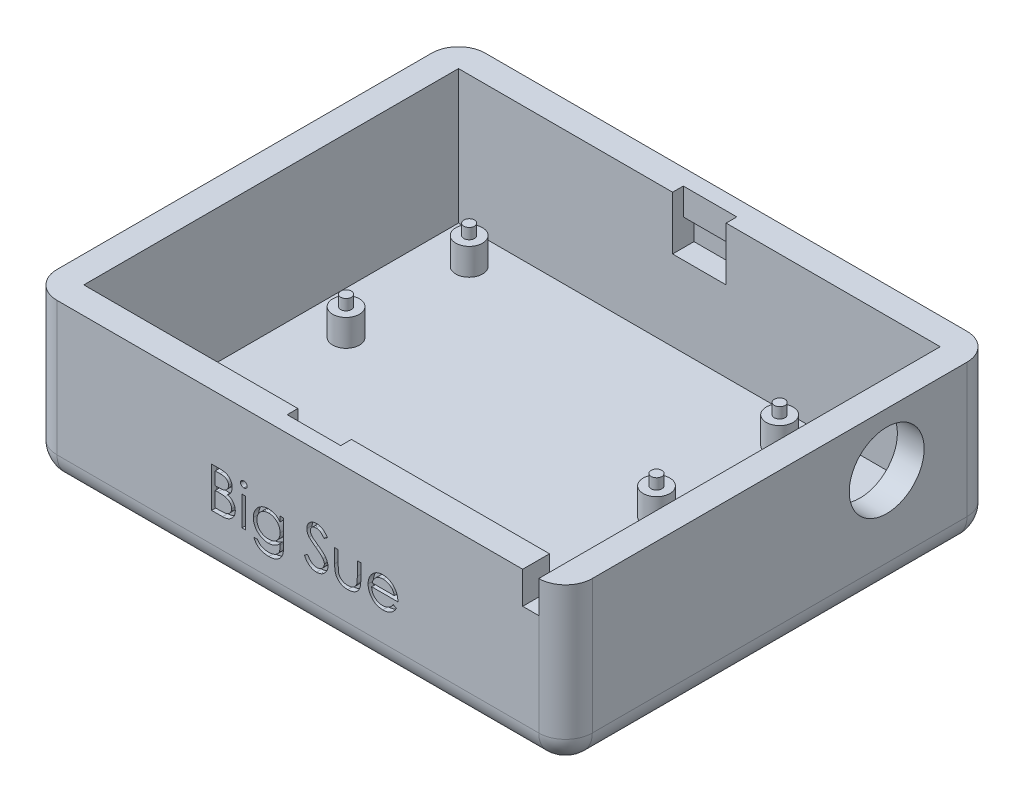
from build123d import *

# Parameters (mm, degrees)
SKETCH1_W            = 100
SKETCH1_H            = 80
BOSS_EXTRUDE1_DEPTH  = 5
SKETCH2_W            = 100
SKETCH2_H            = 80
SKETCH2_W_2          = 90
SKETCH2_H_2          = 70
BOSS_EXTRUDE2_DEPTH  = 25
SKETCH3_R            = 7
CUT_EXTRUDE1_DEPTH   = 25
SKETCH4_R            = 2.5
BOSS_EXTRUDE3_DEPTH  = 5
SKETCH5_R            = 1
BOSS_EXTRUDE4_DEPTH  = 2
LPATTERN1_COUNT      = 2
LPATTERN1_PITCH      = 58
LPATTERN1_COUNT_DIR2 = 2
LPATTERN1_PITCH_DIR2 = 23
SKETCH7_W            = 3
SKETCH7_H            = 6
CUT_EXTRUDE3_DEPTH   = 5
FILLET1_R            = 5
SKETCH8_W            = 10
SKETCH8_H            = 2
CUT_EXTRUDE4_DEPTH   = 10
SKETCH9_W            = 10
SKETCH9_H            = 5
CUT_EXTRUDE5_DEPTH   = 2
SKETCH10_W           = 0.673076924
SKETCH10_H           = 5.480769231
CUT_EXTRUDE6_DEPTH   = 1


with BuildPart() as part:
    # Sketch1 → Boss-Extrude1 (new body)
    with BuildSketch(Plane(origin=(0, 0, 0), x_dir=(1, 0, 0), z_dir=(0, 1, 0))):
        with Locations((50, 40)):
            Rectangle(SKETCH1_W, SKETCH1_H)
    extrude(amount=BOSS_EXTRUDE1_DEPTH)

    # Sketch2 → Boss-Extrude2 (add)
    with BuildSketch(Plane(origin=(0, 5, 0), x_dir=(1, 0, 0), z_dir=(0, 1, 0))):
        with Locations((50, 40)):
            Rectangle(SKETCH2_W, SKETCH2_H)
        with Locations((50, 40)):
            Rectangle(SKETCH2_W_2, SKETCH2_H_2, mode=Mode.SUBTRACT)
    extrude(amount=BOSS_EXTRUDE2_DEPTH)

    # Sketch3 → Cut-Extrude1 (cut)
    with BuildSketch(Plane(origin=(100, 0, 0), x_dir=(0, 0, -1), z_dir=(1, 0, 0))):
        with Locations((60, 20)):
            Circle(SKETCH3_R)
    extrude(amount=-CUT_EXTRUDE1_DEPTH, mode=Mode.SUBTRACT)

    # Sketch4 → Boss-Extrude3 (add)
    with BuildSketch(Plane(origin=(0, 5, 0), x_dir=(1, 0, 0), z_dir=(0, 1, 0))):
        with Locations(Location((13, 69, 0), (0, 0, 90))):
            Circle(SKETCH4_R)
    boss_extrude3 = extrude(amount=BOSS_EXTRUDE3_DEPTH)

    # Sketch5 → Boss-Extrude4 (add)
    with BuildSketch(Plane(origin=(0, 10, 0), x_dir=(1, 0, 0), z_dir=(0, 1, 0))):
        with Locations(Location((13, 69, 0), (0, 0, 270))):
            Circle(SKETCH5_R)
    boss_extrude4 = extrude(amount=BOSS_EXTRUDE4_DEPTH)

    # LPattern1: Boss-Extrude3, Boss-Extrude4 2 × 2
    with Locations(*[(i * LPATTERN1_PITCH, 0, j * LPATTERN1_PITCH_DIR2) for i in range(LPATTERN1_COUNT) for j in range(LPATTERN1_COUNT_DIR2) if (i, j) != (0, 0)]):
        add(boss_extrude3)
        add(boss_extrude4)

    # Sketch7 → Cut-Extrude3 (cut)
    with BuildSketch(Plane.XY):
        with Locations((93.5, 27)):
            Rectangle(SKETCH7_W, SKETCH7_H)
    extrude(amount=-CUT_EXTRUDE3_DEPTH, mode=Mode.SUBTRACT)

    # Fillet1
    fillet1_edges = [part.edges().sort_by_distance(p)[0] for p in [
        (50, 0, 0),
        (100, 0, -40),
        (50, 0, -80),
        (0, 0, -40),
        (0, 15, 0),
        (100, 15, 0),
        (100, 15, -80),
        (0, 15, -80),
    ]]
    fillet(fillet1_edges, radius=FILLET1_R)

    # Sketch8 → Cut-Extrude4 (cut)
    with BuildSketch(Plane(origin=(0, 30, 0), x_dir=(1, 0, 0), z_dir=(0, 1, 0))):
        with Locations((50, 76)):
            Rectangle(SKETCH8_W, SKETCH8_H)
    cut_extrude4 = extrude(amount=-CUT_EXTRUDE4_DEPTH, mode=Mode.SUBTRACT)

    # Sketch9 → Cut-Extrude5 (cut)
    with BuildSketch(Plane.XY.offset(-77)):
        with Locations((50, 22.5)):
            Rectangle(SKETCH9_W, SKETCH9_H)
    cut_extrude5 = extrude(amount=-CUT_EXTRUDE5_DEPTH, mode=Mode.SUBTRACT)

    # Mirror1: Cut-Extrude4, Cut-Extrude5 across plane
    add(cut_extrude4.mirror(Plane.XY.offset(-40)), mode=Mode.SUBTRACT)
    add(cut_extrude5.mirror(Plane.XY.offset(-40)), mode=Mode.SUBTRACT)

    # Sketch10 → Cut-Extrude6 (cut)
    # profile 1 of 7: a face of its own
    with BuildSketch(Plane.XY):
        with BuildLine():
            Line((33.882124968, 17.957661523), (35.345466315, 17.957661523))
            add(Edge.make_bspline(
                [(35.345466315, 17.957661523), (35.417098768, 17.957284915), (35.55594029, 17.956554955), (35.757839094, 17.945233959), (35.946943688, 17.929797524), (36.123308915, 17.905304468), (36.286853277, 17.87575066), (36.438069642, 17.839961054), (36.576477154, 17.797046882), (36.741718732, 17.728804851), (36.930120149, 17.627398062), (37.134116704, 17.477551136), (37.30855436, 17.294267287), (37.458953611, 17.087518739), (37.578527439, 16.860084943), (37.665033076, 16.617386681), (37.719799952, 16.362554377), (37.725432311, 16.18760471), (37.728278815, 16.099187965)],
                knots=[0, 0, 0, 0, 1.001505555, 1.941167018, 2.826882275, 3.653841531, 4.429895133, 5.150066043, 5.825578002, 6.45369114, 7.647487171, 8.808567382, 9.977351308, 11.170798116, 12.373658725, 13.556498008, 14.765093433, 16, 16, 16, 16], degree=3))
            add(Edge.make_bspline(
                [(37.728278815, 16.099187965), (37.725936204, 16.01636106), (37.721332752, 15.853598381), (37.677312554, 15.615539575), (37.608396836, 15.38892982), (37.512599873, 15.174596137), (37.388095595, 14.977381252), (37.240542055, 14.795694253), (37.062520336, 14.637227703), (36.929141964, 14.548635769), (36.861391795, 14.50363508)],
                knots=[0, 0, 0, 0, 1.044552857, 2.05264487, 3.044412934, 4.028983338, 5.005914585, 5.980388656, 6.974128949, 8, 8, 8, 8], degree=3))
            add(Edge.make_bspline(
                [(36.861391795, 14.50363508), (36.946592712, 14.470924368), (37.10960317, 14.408340673), (37.33393034, 14.29769325), (37.527205008, 14.177345871), (37.690913178, 14.045920478), (37.830922438, 13.90425874), (37.953178741, 13.750283496), (38.057495972, 13.581986157), (38.146880808, 13.401121439), (38.216628142, 13.209536149), (38.268862223, 13.009027343), (38.298792471, 12.800314011), (38.303051703, 12.658273912), (38.305201891, 12.586567773)],
                knots=[0, 0, 0, 0, 1.27268992, 2.434971085, 3.483601985, 4.442670788, 5.356604649, 6.2567628, 7.179492994, 8.113709626, 9.066344395, 10.018646069, 10.999752585, 12, 12, 12, 12], degree=3))
            add(Edge.make_bspline(
                [(38.305201891, 12.586567773), (38.30310865, 12.513353047), (38.298990139, 12.369301022), (38.268604485, 12.157682877), (38.217156398, 11.955450848), (38.146289656, 11.761296885), (38.053798982, 11.575596597), (37.941239059, 11.398139603), (37.807028565, 11.230708895), (37.656893846, 11.071443988), (37.487046391, 10.928241586), (37.303798345, 10.800707929), (37.104841945, 10.69582351), (36.893444815, 10.60771775), (36.667235566, 10.540416611), (36.427229979, 10.493332524), (36.173635047, 10.461607444), (35.999614151, 10.458999148), (35.910370161, 10.457661523)],
                knots=[0, 0, 0, 0, 0.978564426, 1.925352924, 2.850884081, 3.763762016, 4.682927383, 5.618979971, 6.567305752, 7.547517671, 8.540179244, 9.531824382, 10.526200242, 11.540722885, 12.589160233, 13.674978461, 14.80764778, 16, 16, 16, 16], degree=3))
            Line((35.910370161, 10.457661523), (33.882124968, 10.457661523))
            Line((33.882124968, 10.457661523), (33.882124968, 17.957661523))
        make_face()
        with BuildLine():
            Line((34.555201891, 17.188430754), (34.555201891, 14.7845846))
            Line((34.555201891, 14.7845846), (35.007425449, 14.7845846))
            add(Edge.make_bspline(
                [(35.007425449, 14.7845846), (35.073530011, 14.785441578), (35.201257495, 14.787097433), (35.386228702, 14.791840684), (35.557925169, 14.805122206), (35.716050526, 14.81839991), (35.860355763, 14.839988312), (35.99052118, 14.865685719), (36.108589602, 14.892863372), (36.244745771, 14.939083702), (36.399187804, 15.007393006), (36.56383017, 15.113404083), (36.708975462, 15.239670554), (36.831540864, 15.385365472), (36.931851158, 15.545793013), (37.001523405, 15.718393471), (37.048767585, 15.898865183), (37.053035152, 16.022761439), (37.055201891, 16.08566633)],
                knots=[0, 0, 0, 0, 1.156816544, 2.235205308, 3.236616184, 4.169592532, 5.011045266, 5.787822928, 6.49130361, 7.128639758, 8.301311294, 9.436451833, 10.541879658, 11.654887649, 12.756523258, 13.837046038, 14.901820046, 16, 16, 16, 16], degree=3))
            add(Edge.make_bspline(
                [(37.055201891, 16.08566633), (37.054074363, 16.127292984), (37.051862591, 16.20894821), (37.033748371, 16.32798254), (37.002960712, 16.439933438), (36.963415798, 16.546335103), (36.908154322, 16.643860497), (36.843089758, 16.73588163), (36.764477564, 16.819264741), (36.674997609, 16.89719938), (36.572121988, 16.966294797), (36.455912077, 17.026810718), (36.324795626, 17.075540954), (36.180982366, 17.118218424), (36.022258607, 17.148193339), (35.850455992, 17.173164884), (35.664167309, 17.185877902), (35.535284946, 17.187560823), (35.46866343, 17.188430754)],
                knots=[0, 0, 0, 0, 0.91205012, 1.789085906, 2.630437955, 3.453916878, 4.269457761, 5.079663411, 5.91843418, 6.774407191, 7.675494373, 8.627863946, 9.638891023, 10.736472738, 11.911756761, 13.175263542, 14.539845004, 16, 16, 16, 16], degree=3))
            Line((35.46866343, 17.188430754), (34.555201891, 17.188430754))
        make_face(mode=Mode.SUBTRACT)
        with BuildLine():
            Line((34.555201891, 14.01535383), (34.555201891, 11.226892292))
            Line((34.555201891, 11.226892292), (35.513735545, 11.226892292))
            add(Edge.make_bspline(
                [(35.513735545, 11.226892292), (35.582347529, 11.227714608), (35.714588084, 11.229299513), (35.905519291, 11.234473559), (36.082483085, 11.246242721), (36.244671947, 11.264769542), (36.393837203, 11.284866218), (36.528189423, 11.311890392), (36.648817695, 11.34285245), (36.788691212, 11.390711391), (36.94619873, 11.465060971), (37.115936279, 11.577162885), (37.266849604, 11.71071283), (37.39500373, 11.865279075), (37.500031563, 12.033346204), (37.57643611, 12.211514811), (37.623559374, 12.396840941), (37.629264022, 12.523198182), (37.632124968, 12.586567773)],
                knots=[0, 0, 0, 0, 1.160039823, 2.235823828, 3.228722157, 4.157150951, 4.99529583, 5.772374946, 6.472645482, 7.099169577, 8.269452708, 9.405989375, 10.527446681, 11.663510218, 12.788923519, 13.866172445, 14.929861265, 16, 16, 16, 16], degree=3))
            add(Edge.make_bspline(
                [(37.632124968, 12.586567773), (37.631533316, 12.62619636), (37.630359555, 12.704814321), (37.612658238, 12.820348219), (37.586914231, 12.932260804), (37.553632587, 13.040855963), (37.5051623, 13.144170341), (37.448576847, 13.244247254), (37.382230986, 13.341218995), (37.278850631, 13.463816681), (37.128482092, 13.605067423), (36.914824716, 13.743362071), (36.671884078, 13.854893086), (36.495682307, 13.902249107), (36.404661026, 13.926712004)],
                knots=[0, 0, 0, 0, 0.723448775, 1.435228256, 2.130040452, 2.821711965, 3.505591119, 4.210454504, 4.921174351, 5.648778258, 7.137944449, 8.670945889, 10.280296675, 12, 12, 12, 12], degree=3))
            add(Edge.make_bspline(
                [(36.404661026, 13.926712004), (36.368170106, 13.934115755), (36.289050266, 13.950168615), (36.160034022, 13.967113694), (36.012742874, 13.982210251), (35.846836709, 13.993377017), (35.662105621, 14.00491961), (35.458155081, 14.009408513), (35.235817978, 14.01476407), (35.081548608, 14.015152215), (35.001415834, 14.01535383)],
                knots=[0, 0, 0, 0, 0.634451884, 1.375622551, 2.216452059, 3.157844607, 4.20941857, 5.370758133, 6.634282058, 8, 8, 8, 8], degree=3))
            Line((35.001415834, 14.01535383), (34.555201891, 14.01535383))
        make_face(mode=Mode.SUBTRACT)
    # profile 2 of 7: a face of its own
    with BuildSketch(Plane.XY):
        with BuildLine():
            add(Edge.make_bspline(
                [(39.888735545, 18.246123061), (39.930502651, 18.244185592), (40.012290665, 18.240391655), (40.130561952, 18.207902775), (40.23825555, 18.152832021), (40.333779263, 18.07894699), (40.415747592, 17.992055326), (40.473134828, 17.890781822), (40.510018534, 17.781370453), (40.514472581, 17.705052405), (40.516740353, 17.666195177)],
                knots=[0, 0, 0, 0, 1.055194115, 2.066272739, 3.074728998, 4.095836921, 5.109056067, 6.073838105, 7.019297344, 8, 8, 8, 8], degree=3))
            add(Edge.make_bspline(
                [(40.516740353, 17.666195177), (40.514421439, 17.628346634), (40.509837221, 17.553524545), (40.473163317, 17.446009962), (40.415258522, 17.34614364), (40.333831824, 17.25942069), (40.238241622, 17.185576504), (40.130565652, 17.130494921), (40.012289691, 17.098008912), (39.930502322, 17.094214579), (39.888735545, 17.092276907)],
                knots=[0, 0, 0, 0, 0.96129708, 1.900370562, 2.859976407, 3.87933698, 4.906634145, 5.921202961, 6.938410037, 8, 8, 8, 8], degree=3))
            add(Edge.make_bspline(
                [(39.888735545, 17.092276907), (39.847446384, 17.094140594), (39.767082427, 17.097768015), (39.65058205, 17.131132339), (39.543806716, 17.185595353), (39.448096703, 17.258937178), (39.368317718, 17.346676243), (39.310249878, 17.445949016), (39.273660674, 17.553540062), (39.269065041, 17.628351847), (39.266740353, 17.666195177)],
                knots=[0, 0, 0, 0, 1.054934014, 2.053291228, 3.073705704, 4.106921865, 5.123545215, 6.088680038, 7.033164197, 8, 8, 8, 8], degree=3))
            add(Edge.make_bspline(
                [(39.266740353, 17.666195177), (39.26901411, 17.705046997), (39.273479912, 17.781354424), (39.310277304, 17.89084378), (39.367834035, 17.991518427), (39.448149528, 18.079430212), (39.543792657, 18.152813286), (39.650585683, 18.207265389), (39.767081467, 18.240632545), (39.847446059, 18.244259576), (39.888735545, 18.246123061)],
                knots=[0, 0, 0, 0, 0.98631895, 1.937192651, 2.907499808, 3.917963147, 4.944918757, 5.95915025, 6.951458133, 8, 8, 8, 8], degree=3))
        make_face()
    # profile 3 of 7: a face of its own
    with BuildSketch(Plane.XY):
        with Locations((39.891740353, 13.198046139)):
            Rectangle(SKETCH10_W, SKETCH10_H)
    # profile 4 of 7: a face of its own
    with BuildSketch(Plane.XY):
        with BuildLine():
            Line((46.670586507, 15.938430754), (47.34366343, 15.938430754))
            Line((47.34366343, 15.938430754), (47.34366343, 11.588971619))
            add(Edge.make_bspline(
                [(47.34366343, 11.588971619), (47.343069767, 11.49631963), (47.341923855, 11.317478975), (47.333671774, 11.058882661), (47.316270323, 10.820026764), (47.296537434, 10.599821924), (47.268151614, 10.399288831), (47.23348797, 10.217829107), (47.194411514, 10.055268616), (47.160082477, 9.955143956), (47.143843718, 9.907781715)],
                knots=[0, 0, 0, 0, 1.307562039, 2.523909702, 3.650326591, 4.686913197, 5.643429486, 6.506965704, 7.293745905, 8, 8, 8, 8], degree=3))
            add(Edge.make_bspline(
                [(47.143843718, 9.907781715), (47.119866778, 9.846217597), (47.072629793, 9.724930089), (46.984160578, 9.552999402), (46.885087928, 9.391114281), (46.771930605, 9.240176885), (46.645200311, 9.10094493), (46.507882828, 8.970393503), (46.357303846, 8.851284573), (46.193549463, 8.745673221), (46.020394534, 8.650558105), (45.837938601, 8.568172604), (45.647210519, 8.496415082), (45.446418609, 8.442666234), (45.238710963, 8.396091833), (45.02164504, 8.365781792), (44.796489046, 8.345152382), (44.643391803, 8.34324474), (44.565718718, 8.342276907)],
                knots=[0, 0, 0, 0, 0.981931301, 1.934503488, 2.87077864, 3.801706999, 4.735015492, 5.667491629, 6.616593066, 7.585388521, 8.561939025, 9.551802639, 10.560317337, 11.588439944, 12.640189604, 13.723962949, 14.845264515, 16, 16, 16, 16], degree=3))
            add(Edge.make_bspline(
                [(44.565718718, 8.342276907), (44.452394287, 8.344112234), (44.231041226, 8.34769712), (43.908316242, 8.389463367), (43.60181327, 8.448508452), (43.315582292, 8.537877226), (43.051432084, 8.647242204), (42.811166637, 8.772802817), (42.596942835, 8.916779907), (42.403820678, 9.080709766), (42.229517271, 9.275631941), (42.065530221, 9.50534375), (41.907685345, 9.773344227), (41.815181121, 9.970042898), (41.766740353, 10.073046138)],
                knots=[0, 0, 0, 0, 1.157897085, 2.2616841, 3.32207898, 4.345638746, 5.321241055, 6.241986252, 7.112515963, 7.955008012, 8.825025602, 9.77857164, 10.836726669, 12, 12, 12, 12], degree=3))
            Line((41.766740353, 10.073046138), (42.439817276, 10.073046138))
            add(Edge.make_bspline(
                [(42.439817276, 10.073046138), (42.493950582, 9.987104976), (42.599774528, 9.819100586), (42.79766413, 9.601572395), (43.01453483, 9.415672328), (43.257705579, 9.265863526), (43.528188184, 9.152913973), (43.826145368, 9.072395481), (44.154001701, 9.024189195), (44.382255017, 9.018379279), (44.501115353, 9.01535383)],
                knots=[0, 0, 0, 0, 0.997731894, 1.950442991, 2.880492273, 3.800895997, 4.748200782, 5.754801363, 6.83083817, 8, 8, 8, 8], degree=3))
            add(Edge.make_bspline(
                [(44.501115353, 9.01535383), (44.618472975, 9.018418435), (44.844726724, 9.024326686), (45.170079229, 9.072416995), (45.467068382, 9.152931496), (45.733983097, 9.265663752), (45.96767403, 9.403771766), (46.169128297, 9.55805764), (46.33229546, 9.732016932), (46.442037532, 9.892263659), (46.510254569, 10.035029651), (46.553695077, 10.157928071), (46.58899644, 10.296898523), (46.618524663, 10.451475101), (46.642890906, 10.621878652), (46.658325654, 10.808498802), (46.669480964, 11.010911421), (46.670209471, 11.15125386), (46.670586507, 11.223887484)],
                knots=[0, 0, 0, 0, 1.570740765, 3.028230971, 4.391408896, 5.680370741, 6.894727393, 8.017376726, 9.065722033, 10.075533815, 10.603371122, 11.180248986, 11.817768598, 12.521299649, 13.286540596, 14.121245857, 15.027658897, 16, 16, 16, 16], degree=3))
            Line((46.670586507, 11.223887484), (46.670586507, 11.507841811))
            add(Edge.make_bspline(
                [(46.670586507, 11.507841811), (46.602269827, 11.426537949), (46.466838136, 11.265360336), (46.232951006, 11.054156829), (45.977486187, 10.872257978), (45.700878596, 10.72307519), (45.409903792, 10.603757851), (45.107713298, 10.520308649), (44.797016037, 10.466394578), (44.586475716, 10.460593186), (44.480081699, 10.457661523)],
                knots=[0, 0, 0, 0, 1.012485704, 2.007162095, 2.997754123, 3.998611389, 4.999708251, 5.992315798, 6.98544096, 8, 8, 8, 8], degree=3))
            add(Edge.make_bspline(
                [(44.480081699, 10.457661523), (44.41743255, 10.458765151), (44.292875641, 10.460959347), (44.107829754, 10.480156727), (43.925514529, 10.508011175), (43.746355165, 10.548899973), (43.570093137, 10.601382244), (43.397019725, 10.666989541), (43.225733596, 10.741164795), (43.059348244, 10.828535088), (42.899520821, 10.925740031), (42.747456853, 11.031037654), (42.60395284, 11.143876843), (42.470374649, 11.265370285), (42.346897496, 11.395342141), (42.231860636, 11.532406898), (42.12716632, 11.678478486), (42.030666201, 11.830893395), (41.94697145, 11.990666804), (41.873504939, 12.154334151), (41.809627642, 12.321545482), (41.758701781, 12.492860616), (41.719806539, 12.66817155), (41.690856052, 12.847191083), (41.674435484, 13.030470485), (41.671874933, 13.153944805), (41.670586507, 13.216074984)],
                knots=[0, 0, 0, 0, 1.028754217, 2.045334182, 3.052854819, 4.056607503, 5.061168794, 6.071104265, 7.095078842, 8.125279047, 9.155117945, 10.165957491, 11.161587969, 12.151493252, 13.128948131, 14.104219989, 15.088194871, 16.07871515, 17.064853787, 18.047899887, 19.02414258, 20.002704429, 20.980574569, 21.971845993, 22.979467364, 24, 24, 24, 24], degree=3))
            add(Edge.make_bspline(
                [(41.670586507, 13.216074984), (41.671699006, 13.278224476), (41.673919695, 13.402282745), (41.693100366, 13.586309999), (41.720460771, 13.767873075), (41.763763134, 13.945100521), (41.815882825, 14.120010703), (41.880433337, 14.291311681), (41.958044964, 14.459055629), (42.045922999, 14.623366768), (42.144674627, 14.782040229), (42.252958514, 14.932740184), (42.370905387, 15.074357696), (42.496888064, 15.208321457), (42.632444815, 15.333338942), (42.777505512, 15.449106724), (42.930640256, 15.557565352), (43.092323649, 15.65637536), (43.26006091, 15.743765888), (43.429590519, 15.823507167), (43.603158166, 15.886794566), (43.777527893, 15.94255835), (43.955770568, 15.98206234), (44.135700697, 16.012538573), (44.317934278, 16.031105832), (44.439976196, 16.033423514), (44.501115353, 16.0345846)],
                knots=[0, 0, 0, 0, 1.008818848, 2.013730394, 3.001654427, 3.987803273, 4.973046549, 5.963777569, 6.957074694, 7.972068341, 8.987420212, 9.989399531, 10.982630087, 11.977756091, 12.973280677, 13.973972381, 14.989194003, 16.018387222, 17.047741039, 18.059210846, 19.057554164, 20.045176975, 21.029480261, 22.018708529, 23.007435371, 24, 24, 24, 24], degree=3))
            add(Edge.make_bspline(
                [(44.501115353, 16.0345846), (44.601938794, 16.031677443), (44.801034109, 16.025936701), (45.094029115, 15.980891389), (45.376762486, 15.909075646), (45.650829662, 15.80618501), (45.9184632, 15.665720642), (46.178781033, 15.480700039), (46.432536321, 15.249463597), (46.589131672, 15.07213603), (46.670586507, 14.9798971)],
                knots=[0, 0, 0, 0, 0.96728863, 1.910097829, 2.838038873, 3.762875196, 4.71315279, 5.730631239, 6.819562287, 8, 8, 8, 8], degree=3))
            Line((46.670586507, 14.9798971), (46.670586507, 15.938430754))
        make_face()
        with BuildLine():
            add(Edge.make_bspline(
                [(44.555201891, 15.361507677), (44.456778955, 15.358162536), (44.261922409, 15.351539868), (43.976304533, 15.295001197), (43.700568247, 15.206402839), (43.439985186, 15.079668664), (43.195898522, 14.925181011), (42.979309621, 14.738023252), (42.789870515, 14.524281401), (42.629621362, 14.285888015), (42.502054148, 14.028697424), (42.411746821, 13.757602994), (42.353353914, 13.476985152), (42.346908945, 13.285472431), (42.34366343, 13.189031715)],
                knots=[0, 0, 0, 0, 1.026226791, 2.031711442, 3.026614839, 4.04107745, 5.047145931, 6.032893242, 7.017642609, 8.019221815, 9.021877557, 10.003543541, 10.994637589, 12, 12, 12, 12], degree=3))
            add(Edge.make_bspline(
                [(42.34366343, 13.189031715), (42.345218623, 13.11631756), (42.348277233, 12.97331008), (42.3776849, 12.763443162), (42.42521554, 12.563556776), (42.492580982, 12.373638831), (42.576051042, 12.192599985), (42.681034694, 12.021687339), (42.804572491, 11.860748683), (42.945697501, 11.710974365), (43.101218319, 11.574558004), (43.269902317, 11.454690774), (43.45152071, 11.356653515), (43.641606732, 11.271923148), (43.844772637, 11.210039431), (44.058092107, 11.162813476), (44.283074314, 11.13579471), (44.436442327, 11.132445858), (44.514636988, 11.130738446)],
                knots=[0, 0, 0, 0, 1.039728707, 2.044842319, 3.024901384, 3.974314358, 4.923051295, 5.871625912, 6.837440708, 7.820715446, 8.810779094, 9.792721783, 10.773906224, 11.758876063, 12.764959493, 13.806266761, 14.881525401, 16, 16, 16, 16], degree=3))
            add(Edge.make_bspline(
                [(44.514636988, 11.130738446), (44.593845041, 11.132383322), (44.74873555, 11.135599861), (44.974958985, 11.163250215), (45.189314857, 11.207868736), (45.391606619, 11.271218076), (45.582598064, 11.352050398), (45.760143667, 11.45434315), (45.928050342, 11.570838362), (46.080956934, 11.706721249), (46.219223003, 11.85647481), (46.339717503, 12.019428156), (46.442391322, 12.193129269), (46.527414901, 12.377558567), (46.592324624, 12.574149323), (46.635865135, 12.782410086), (46.66630816, 13.001343097), (46.669138713, 13.151361561), (46.670586507, 13.228094215)],
                knots=[0, 0, 0, 0, 1.121943988, 2.193949579, 3.223793937, 4.220241907, 5.192961521, 6.155822191, 7.11847367, 8.083710714, 9.04790392, 10.001595906, 10.949595423, 11.902125208, 12.873731292, 13.87582262, 14.913508608, 16, 16, 16, 16], degree=3))
            add(Edge.make_bspline(
                [(46.670586507, 13.228094215), (46.667716004, 13.327989616), (46.662108049, 13.523150127), (46.609185568, 13.807521773), (46.523856547, 14.074883217), (46.404184934, 14.324388879), (46.254223487, 14.553395057), (46.07360024, 14.757660438), (45.865430174, 14.937447988), (45.630311388, 15.087229831), (45.377352577, 15.208227191), (45.1126643, 15.299002417), (44.83663952, 15.350418806), (44.649554357, 15.357790113), (44.555201891, 15.361507677)],
                knots=[0, 0, 0, 0, 1.070913519, 2.092188694, 3.091357305, 4.074328408, 5.051968682, 6.018948707, 6.99050112, 7.9935919, 9.000589572, 9.992915277, 10.987769056, 12, 12, 12, 12], degree=3))
        make_face(mode=Mode.SUBTRACT)
    # profile 5 of 7: a face of its own
    with BuildSketch(Plane.XY):
        with BuildLine():
            Line((51.189817276, 11.904476427), (51.823831699, 12.2845846))
            add(Edge.make_bspline(
                [(51.823831699, 12.2845846), (51.88279935, 12.185875203), (51.995779095, 11.996751809), (52.184246293, 11.741198866), (52.379531102, 11.523994244), (52.583079674, 11.346401513), (52.793649563, 11.20658247), (53.012615393, 11.107577688), (53.239239273, 11.04582917), (53.39346889, 11.038328984), (53.470466315, 11.0345846)],
                knots=[0, 0, 0, 0, 1.272034388, 2.437168799, 3.508375237, 4.49857839, 5.41946034, 6.295179144, 7.148887113, 8, 8, 8, 8], degree=3))
            add(Edge.make_bspline(
                [(53.470466315, 11.0345846), (53.536223873, 11.036416041), (53.666588386, 11.040046877), (53.858507479, 11.07493431), (54.044897055, 11.128531729), (54.221915564, 11.205290868), (54.387120453, 11.298159052), (54.531991943, 11.410329432), (54.657233614, 11.535914159), (54.759681716, 11.676019847), (54.838281792, 11.826699451), (54.898693367, 11.981362204), (54.932218525, 12.142437708), (54.937268711, 12.2508887), (54.939817276, 12.305618254)],
                knots=[0, 0, 0, 0, 1.095163259, 2.171163733, 3.241058638, 4.321873601, 5.38011039, 6.391990106, 7.366004449, 8.327778327, 9.272591725, 10.192022065, 11.087607919, 12, 12, 12, 12], degree=3))
            add(Edge.make_bspline(
                [(54.939817276, 12.305618254), (54.936658039, 12.368062931), (54.930235771, 12.495003837), (54.875954028, 12.682288807), (54.790562785, 12.867630029), (54.711785691, 12.982275598), (54.670886988, 13.041796138)],
                knots=[0, 0, 0, 0, 0.938893495, 1.908633276, 2.914225137, 4, 4, 4, 4], degree=3))
            add(Edge.make_bspline(
                [(54.670886988, 13.041796138), (54.6373071, 13.084753617), (54.566810327, 13.174937471), (54.445615657, 13.309177262), (54.303402555, 13.447645302), (54.145037794, 13.595628996), (53.964752604, 13.746245703), (53.768193644, 13.906677727), (53.550342518, 14.070823964), (53.397557882, 14.180908033), (53.318723526, 14.2377096)],
                knots=[0, 0, 0, 0, 0.722233717, 1.516239348, 2.393582979, 3.351407094, 4.387010283, 5.505090956, 6.712668013, 8, 8, 8, 8], degree=3))
            add(Edge.make_bspline(
                [(53.318723526, 14.2377096), (53.239814963, 14.293913716), (53.088947799, 14.401371707), (52.877965122, 14.560852315), (52.689298416, 14.706660607), (52.523786238, 14.840169204), (52.381501387, 14.961396215), (52.261322649, 15.069177513), (52.166311456, 15.166428), (52.113478068, 15.22951659), (52.08975718, 15.257841811)],
                knots=[0, 0, 0, 0, 1.452282411, 2.77665338, 3.964542531, 5.026858415, 5.96415736, 6.766646006, 7.446254459, 8, 8, 8, 8], degree=3))
            add(Edge.make_bspline(
                [(52.08975718, 15.257841811), (52.056601726, 15.30198689), (51.991397076, 15.388804113), (51.905327064, 15.524500236), (51.832171715, 15.663407234), (51.774823861, 15.805898372), (51.726531963, 15.94997322), (51.694050683, 16.097511603), (51.673711975, 16.2478515), (51.671629147, 16.349023287), (51.670586507, 16.399668734)],
                knots=[0, 0, 0, 0, 1.068054152, 2.10047183, 3.106115577, 4.101338837, 5.06977816, 6.043150881, 7.020423561, 8, 8, 8, 8], degree=3))
            add(Edge.make_bspline(
                [(51.670586507, 16.399668734), (51.673383383, 16.479018251), (51.678917355, 16.636021245), (51.725718463, 16.865373024), (51.79958895, 17.084343919), (51.903077995, 17.290766062), (52.036486609, 17.479264593), (52.190870839, 17.652007779), (52.374752596, 17.79722617), (52.576508217, 17.924109152), (52.7973433, 18.023421849), (53.028752379, 18.098338235), (53.271103247, 18.140786644), (53.435252821, 18.146878283), (53.518543238, 18.149969215)],
                knots=[0, 0, 0, 0, 1.005424448, 1.989358655, 2.955360095, 3.929531133, 4.905563448, 5.876582895, 6.856512386, 7.866279853, 8.892233794, 9.918561126, 10.94386622, 12, 12, 12, 12], degree=3))
            add(Edge.make_bspline(
                [(53.518543238, 18.149969215), (53.606923453, 18.14692089), (53.782683492, 18.140858745), (54.041217525, 18.088149749), (54.290133346, 18.000934024), (54.490368914, 17.901958328), (54.647081974, 17.803105295), (54.766594973, 17.713062814), (54.887703796, 17.609401867), (55.011385342, 17.49184634), (55.135543898, 17.359317587), (55.262022724, 17.212723254), (55.391117586, 17.052959206), (55.474165857, 16.938906704), (55.516740353, 16.880437965)],
                knots=[0, 0, 0, 0, 1.286793592, 2.559021753, 3.825965368, 5.121522368, 5.803751409, 6.523245864, 7.299691795, 8.125521123, 9.008227632, 9.944561021, 10.946284179, 12, 12, 12, 12], degree=3))
            Line((55.516740353, 16.880437965), (54.908266795, 16.419199984))
            add(Edge.make_bspline(
                [(54.908266795, 16.419199984), (54.871525511, 16.466532892), (54.800770389, 16.557685006), (54.69335006, 16.685337826), (54.592102957, 16.801944567), (54.492352101, 16.903226985), (54.399365748, 16.994731556), (54.309114943, 17.073073892), (54.222898476, 17.139021597), (54.114219382, 17.209400654), (53.977681414, 17.27916459), (53.806285979, 17.338198329), (53.627172533, 17.373673461), (53.505180465, 17.378363935), (53.443423045, 17.380738446)],
                knots=[0, 0, 0, 0, 1.181633172, 2.275549214, 3.290209073, 4.226197932, 5.078386478, 5.862611352, 6.581680152, 7.217281963, 8.414376989, 9.595101626, 10.782541182, 12, 12, 12, 12], degree=3))
            add(Edge.make_bspline(
                [(53.443423045, 17.380738446), (53.365944783, 17.378141946), (53.216535253, 17.373134841), (53.004413318, 17.318449158), (52.813497765, 17.232345171), (52.649456554, 17.111670218), (52.512877317, 16.968696663), (52.414079906, 16.804170545), (52.354615267, 16.622493968), (52.347358954, 16.495761847), (52.34366343, 16.431219215)],
                knots=[0, 0, 0, 0, 1.14458467, 2.207223713, 3.21896685, 4.227309161, 5.202851033, 6.127160689, 7.046193047, 8, 8, 8, 8], degree=3))
            add(Edge.make_bspline(
                [(52.34366343, 16.431219215), (52.344505844, 16.391037475), (52.34619205, 16.310608291), (52.369709474, 16.191783815), (52.399922321, 16.073259516), (52.44779939, 15.955568268), (52.513896469, 15.836651784), (52.600693274, 15.714462346), (52.710007514, 15.587922971), (52.793743969, 15.505621455), (52.837954295, 15.462168734)],
                knots=[0, 0, 0, 0, 0.858281714, 1.717966888, 2.583508476, 3.4729293, 4.427298488, 5.488583878, 6.674047936, 8, 8, 8, 8], degree=3))
            add(Edge.make_bspline(
                [(52.837954295, 15.462168734), (52.854371522, 15.447517965), (52.893375094, 15.41271109), (52.96468065, 15.355727631), (53.058843789, 15.285435976), (53.173405648, 15.198463155), (53.310478566, 15.097574308), (53.470077615, 14.984059425), (53.650423757, 14.854233441), (53.778399291, 14.763467283), (53.846067276, 14.715474023)],
                knots=[0, 0, 0, 0, 0.420754252, 0.999615792, 1.744751191, 2.668019286, 3.750313428, 4.999500688, 6.413464383, 8, 8, 8, 8], degree=3))
            add(Edge.make_bspline(
                [(53.846067276, 14.715474023), (53.927465662, 14.656242538), (54.085082354, 14.541548977), (54.309348597, 14.369229663), (54.512692471, 14.20069873), (54.695827907, 14.037032429), (54.86056414, 13.87947223), (55.005073541, 13.726122558), (55.130828571, 13.578082045), (55.26621261, 13.388283668), (55.404550795, 13.155181345), (55.523354025, 12.86958512), (55.598264769, 12.582878718), (55.608060874, 12.390178355), (55.612894199, 12.295101427)],
                knots=[0, 0, 0, 0, 1.163667725, 2.253281268, 3.268753668, 4.215851969, 5.092017293, 5.902905408, 6.650798638, 7.335211899, 8.59617414, 9.77448103, 10.901945474, 12, 12, 12, 12], degree=3))
            add(Edge.make_bspline(
                [(55.612894199, 12.295101427), (55.611486046, 12.227862073), (55.608697085, 12.094689108), (55.576637984, 11.899142515), (55.529667273, 11.709219223), (55.4588732, 11.527266839), (55.372466433, 11.349956633), (55.262824473, 11.181939704), (55.135736577, 11.019497421), (54.989949938, 10.866961368), (54.830423005, 10.726933805), (54.661815087, 10.602371531), (54.483850217, 10.498510838), (54.297493824, 10.413759033), (54.102703102, 10.347472924), (53.899543566, 10.299445348), (53.687680327, 10.269968824), (53.543679295, 10.266909335), (53.470466315, 10.26535383)],
                knots=[0, 0, 0, 0, 0.983748083, 1.948392443, 2.894712957, 3.844097841, 4.80183111, 5.778335162, 6.776009319, 7.81870978, 8.863265674, 9.881300176, 10.883814829, 11.87499822, 12.874611388, 13.892143829, 14.928324115, 16, 16, 16, 16], degree=3))
            add(Edge.make_bspline(
                [(53.470466315, 10.26535383), (53.413819151, 10.26644922), (53.301238237, 10.268626203), (53.134717918, 10.287871803), (52.971561656, 10.315101311), (52.813816766, 10.358331461), (52.659450884, 10.410782126), (52.509135381, 10.475364268), (52.362797408, 10.552758271), (52.219616874, 10.641247609), (52.079957928, 10.74422849), (51.945130497, 10.864171697), (51.810710814, 10.997769208), (51.680666393, 11.148648986), (51.552366798, 11.31437345), (51.428341635, 11.496493128), (51.306023668, 11.694016029), (51.229276237, 11.833012641), (51.189817276, 11.904476427)],
                knots=[0, 0, 0, 0, 0.915332311, 1.819136955, 2.706846663, 3.586547465, 4.459518054, 5.340707479, 6.227863349, 7.133153174, 8.059268498, 9.028702269, 10.047606654, 11.120612155, 12.245963614, 13.433783089, 14.680604001, 16, 16, 16, 16], degree=3))
        make_face()
    # profile 6 of 7: a face of its own
    with BuildSketch(Plane.XY):
        with BuildLine():
            Line((56.862894199, 15.938430754), (57.535971122, 15.938430754))
            Line((57.535971122, 15.938430754), (57.535971122, 13.396363446))
            add(Edge.make_bspline(
                [(57.535971122, 13.396363446), (57.536275204, 13.321743269), (57.536856899, 13.178998366), (57.540801772, 12.973594394), (57.550080544, 12.786272867), (57.561681597, 12.616925574), (57.57660046, 12.465581164), (57.594350518, 12.332768256), (57.614189993, 12.216980719), (57.633610094, 12.147244956), (57.642641795, 12.114812965)],
                knots=[0, 0, 0, 0, 1.388932606, 2.656963016, 3.823490214, 4.879454478, 5.816252168, 6.653371382, 7.373723809, 8, 8, 8, 8], degree=3))
            add(Edge.make_bspline(
                [(57.642641795, 12.114812965), (57.657130628, 12.07404967), (57.685807073, 11.993370539), (57.737821681, 11.876822671), (57.802168116, 11.768875637), (57.872582033, 11.66536691), (57.953795049, 11.569362652), (58.04477963, 11.481024987), (58.142490138, 11.39701622), (58.287679474, 11.297620238), (58.486235044, 11.191087387), (58.74691952, 11.099167777), (59.029571432, 11.044233876), (59.224924402, 11.037860473), (59.325334103, 11.0345846)],
                knots=[0, 0, 0, 0, 0.725840625, 1.436591201, 2.137033971, 2.831655856, 3.53531722, 4.242432219, 4.957935707, 5.694543706, 7.190802206, 8.724350549, 10.316345118, 12, 12, 12, 12], degree=3))
            add(Edge.make_bspline(
                [(59.325334103, 11.0345846), (59.425734477, 11.037930132), (59.619990623, 11.044403119), (59.899536986, 11.097510702), (60.155075731, 11.186237178), (60.384042055, 11.310110204), (60.585397427, 11.461700338), (60.75319261, 11.639576357), (60.891636727, 11.838110757), (60.952085485, 11.986234212), (60.982485545, 12.060726427)],
                knots=[0, 0, 0, 0, 1.157059328, 2.238695713, 3.266970494, 4.264342957, 5.228770407, 6.160125903, 7.074715775, 8, 8, 8, 8], degree=3))
            add(Edge.make_bspline(
                [(60.982485545, 12.060726427), (60.991473181, 12.090654209), (61.011342649, 12.156817228), (61.032690545, 12.269059546), (61.051921534, 12.40291227), (61.068342626, 12.559251289), (61.080053689, 12.737668044), (61.086366603, 12.938106779), (61.093498621, 13.159938265), (61.09360687, 13.31522632), (61.09366343, 13.396363446)],
                knots=[0, 0, 0, 0, 0.557542046, 1.232589297, 2.036731608, 2.971723315, 4.038036528, 5.22795436, 6.551621927, 8, 8, 8, 8], degree=3))
            Line((61.09366343, 13.396363446), (61.09366343, 15.938430754))
            Line((61.09366343, 15.938430754), (61.766740353, 15.938430754))
            Line((61.766740353, 15.938430754), (61.766740353, 13.270161523))
            add(Edge.make_bspline(
                [(61.766740353, 13.270161523), (61.765793864, 13.179503298), (61.763957546, 13.003613941), (61.752156096, 12.748005131), (61.731906926, 12.509800321), (61.701172601, 12.288873421), (61.66503187, 12.085393103), (61.618411285, 11.899098576), (61.562743632, 11.730563817), (61.4999461, 11.576831438), (61.425756384, 11.437445236), (61.34684134, 11.305154201), (61.255716829, 11.183240768), (61.159780613, 11.065636189), (61.053062779, 10.958190058), (60.937563081, 10.858436896), (60.814907181, 10.764851828), (60.682373186, 10.6810848), (60.541895908, 10.60562056), (60.393301929, 10.538728964), (60.234771218, 10.485794871), (60.068349139, 10.440129158), (59.893220326, 10.404312439), (59.709553612, 10.37905551), (59.517410863, 10.363572658), (59.386462021, 10.362207562), (59.319324488, 10.361507677)],
                knots=[0, 0, 0, 0, 1.493040784, 2.896703357, 4.213163133, 5.428574705, 6.569057535, 7.615249723, 8.588095153, 9.490268104, 10.346124644, 11.18633936, 12.024365274, 12.850166724, 13.684164916, 14.514361689, 15.362232829, 16.222528818, 17.093394965, 17.986930858, 18.902426812, 19.842810585, 20.827885679, 21.843828298, 22.894529745, 24, 24, 24, 24], degree=3))
            add(Edge.make_bspline(
                [(59.319324488, 10.361507677), (59.2526891, 10.362235621), (59.121744361, 10.363666098), (58.929591695, 10.378969972), (58.74541611, 10.404273194), (58.569872399, 10.440391517), (58.402784404, 10.485475239), (58.243475319, 10.539054243), (58.093810541, 10.605655276), (57.951991961, 10.680607184), (57.819129701, 10.765389918), (57.694611319, 10.858321431), (57.578603778, 10.959262995), (57.471081489, 11.067793046), (57.373553682, 11.185257909), (57.284805021, 11.310712681), (57.203469225, 11.4429143), (57.129856103, 11.584478219), (57.066616626, 11.739989669), (57.010783957, 11.912054877), (56.965118303, 12.10256027), (56.927955871, 12.311342974), (56.898059927, 12.537403777), (56.877303907, 12.782050382), (56.865698556, 13.044686865), (56.863849139, 13.226079486), (56.862894199, 13.31974085)],
                knots=[0, 0, 0, 0, 1.083640291, 2.129454052, 3.13281866, 4.105697902, 5.042300162, 5.946461698, 6.836384745, 7.703652036, 8.553297018, 9.397182691, 10.228592656, 11.052265423, 11.879314572, 12.708807002, 13.549817954, 14.402308542, 15.300838682, 16.27712199, 17.341985831, 18.484375296, 19.725102775, 21.0496083, 22.476576903, 24, 24, 24, 24], degree=3))
            Line((56.862894199, 13.31974085), (56.862894199, 15.938430754))
        make_face()
    # profile 7 of 7: a face of its own
    with BuildSketch(Plane.XY):
        with BuildLine():
            Line((67.803399007, 12.188430754), (68.401355738, 11.87442835))
            add(Edge.make_bspline(
                [(68.401355738, 11.87442835), (68.353705891, 11.789906926), (68.260998158, 11.625461705), (68.101567984, 11.39953629), (67.934442114, 11.196291185), (67.752076469, 11.021156211), (67.559927157, 10.868474672), (67.356928611, 10.734893619), (67.142024001, 10.621068218), (66.915203162, 10.525169944), (66.674561267, 10.451435314), (66.41951516, 10.39935484), (66.149576242, 10.367162122), (65.964548714, 10.363422535), (65.869805257, 10.361507677)],
                knots=[0, 0, 0, 0, 1.120438281, 2.179929193, 3.190490725, 4.156257408, 5.095198341, 6.022838206, 6.959905092, 7.901321166, 8.864066838, 9.862729781, 10.905609505, 12, 12, 12, 12], degree=3))
            add(Edge.make_bspline(
                [(65.869805257, 10.361507677), (65.764501019, 10.363965909), (65.559082959, 10.36876121), (65.260069215, 10.410102205), (64.97854189, 10.477542973), (64.714516811, 10.571754848), (64.468640556, 10.6948134), (64.240424438, 10.844726575), (64.028668311, 11.020724264), (63.840045006, 11.224330928), (63.670236686, 11.442220837), (63.520395643, 11.669269161), (63.395129719, 11.904904642), (63.293231269, 12.147627193), (63.21093513, 12.395906965), (63.153577907, 12.652002967), (63.120514162, 12.915222076), (63.115447493, 13.093287795), (63.112894199, 13.1830221)],
                knots=[0, 0, 0, 0, 1.145258523, 2.234067595, 3.276747158, 4.290159414, 5.277019952, 6.260822364, 7.254936242, 8.264827045, 9.274100331, 10.257902744, 11.220704747, 12.172965371, 13.118907548, 14.062713208, 15.023725156, 16, 16, 16, 16], degree=3))
            add(Edge.make_bspline(
                [(63.112894199, 13.1830221), (63.115163788, 13.267225308), (63.119661813, 13.434104946), (63.1480135, 13.681102542), (63.198259842, 13.921163511), (63.267209108, 14.154487329), (63.356247492, 14.38068333), (63.465173676, 14.599889181), (63.594157343, 14.811871623), (63.693741644, 14.945592624), (63.743903815, 15.012949984)],
                knots=[0, 0, 0, 0, 1.024358464, 2.0301432, 3.019427413, 4.004406732, 4.986367066, 5.972626655, 6.978780325, 8, 8, 8, 8], degree=3))
            add(Edge.make_bspline(
                [(63.743903815, 15.012949984), (63.811848849, 15.094097563), (63.945586592, 15.253822171), (64.171778782, 15.463690012), (64.416707774, 15.639498102), (64.677304116, 15.785227679), (64.95659656, 15.895956923), (65.250830755, 15.97847317), (65.563357011, 16.024711766), (65.777011056, 16.031242838), (65.886331699, 16.0345846)],
                knots=[0, 0, 0, 0, 1.030682036, 2.02871468, 2.997146059, 3.962720338, 4.930598197, 5.918074684, 6.934738563, 8, 8, 8, 8], degree=3))
            add(Edge.make_bspline(
                [(65.886331699, 16.0345846), (65.998719425, 16.031683066), (66.219198523, 16.025990919), (66.540695925, 15.973220205), (66.844897461, 15.889536159), (67.131681399, 15.771349465), (67.401076815, 15.618864712), (67.651332635, 15.429989337), (67.886728733, 15.210522007), (68.023675688, 15.041743701), (68.093362949, 14.955858638)],
                knots=[0, 0, 0, 0, 1.056321875, 2.072262726, 3.055038591, 4.01806755, 4.982017516, 5.957941055, 6.960871419, 8, 8, 8, 8], degree=3))
            add(Edge.make_bspline(
                [(68.093362949, 14.955858638), (68.140777817, 14.891136678), (68.235291945, 14.762123567), (68.353678588, 14.551756801), (68.456444434, 14.331662671), (68.538586494, 14.098283463), (68.605099711, 13.854384362), (68.653221465, 13.598221766), (68.681442076, 13.329871956), (68.686989285, 13.147029337), (68.689817276, 13.053815369)],
                knots=[0, 0, 0, 0, 0.94817472, 1.890038105, 2.849395472, 3.817997239, 4.812318967, 5.836947057, 6.897266129, 8, 8, 8, 8], degree=3))
            Line((68.689817276, 13.053815369), (63.785971122, 13.053815369))
            add(Edge.make_bspline(
                [(63.785971122, 13.053815369), (63.789270279, 12.981600088), (63.795757937, 12.839591652), (63.826004673, 12.631797117), (63.873680617, 12.433854241), (63.940685751, 12.247247722), (64.021828991, 12.069540306), (64.121226955, 11.902050227), (64.239811714, 11.745540377), (64.372081069, 11.598610796), (64.519310559, 11.467766308), (64.674202161, 11.350655359), (64.838974086, 11.252500509), (65.012327122, 11.172829316), (65.193980947, 11.110458639), (65.383992794, 11.067884738), (65.581988757, 11.039369509), (65.716958187, 11.036198797), (65.785670641, 11.0345846)],
                knots=[0, 0, 0, 0, 1.094153842, 2.151609401, 3.174256925, 4.172055639, 5.149267565, 6.128595816, 7.11444997, 8.118368179, 9.117203808, 10.09244225, 11.054858984, 12.015122123, 12.976791628, 13.957293641, 14.960065497, 16, 16, 16, 16], degree=3))
            add(Edge.make_bspline(
                [(65.785670641, 11.0345846), (65.852851672, 11.035887578), (65.986151724, 11.038472938), (66.184667847, 11.063612747), (66.379966834, 11.104263337), (66.57124037, 11.159741888), (66.754606468, 11.227406571), (66.924418361, 11.309055551), (67.080590252, 11.399376437), (67.22655518, 11.502682884), (67.36813588, 11.629128999), (67.508584065, 11.786919829), (67.659176894, 11.97353596), (67.753440307, 12.113990959), (67.803399007, 12.188430754)],
                knots=[0, 0, 0, 0, 0.99110716, 1.966546729, 2.947904876, 3.932708344, 4.903319531, 5.828989031, 6.710028674, 7.56322171, 8.463672341, 9.504779593, 10.677557249, 12, 12, 12, 12], degree=3))
        make_face()
        with BuildLine():
            add(Edge.make_bspline(
                [(68.016740353, 13.726892292), (67.992104729, 13.816169879), (67.944689083, 13.988000494), (67.845611159, 14.225945259), (67.734029286, 14.437419333), (67.601982719, 14.620804261), (67.452371164, 14.783668932), (67.279560058, 14.925994471), (67.085768858, 15.053317581), (66.871999271, 15.160787222), (66.645624017, 15.252265491), (66.408610749, 15.313605025), (66.166772632, 15.355625473), (66.003199161, 15.359538562), (65.920886988, 15.361507677)],
                knots=[0, 0, 0, 0, 1.154881502, 2.222775134, 3.210006277, 4.132804581, 5.035138423, 5.962687519, 6.919655026, 7.923214229, 8.944639381, 9.960483929, 10.97369054, 12, 12, 12, 12], degree=3))
            add(Edge.make_bspline(
                [(65.920886988, 15.361507677), (65.853709619, 15.360196952), (65.720914086, 15.357605925), (65.52526894, 15.333027076), (65.33738387, 15.292398837), (65.15587254, 15.236759644), (64.983113536, 15.162598353), (64.815553319, 15.075634296), (64.65745247, 14.96947376), (64.558578265, 14.888561928), (64.508627372, 14.847685561)],
                knots=[0, 0, 0, 0, 1.04873581, 2.073130211, 3.073294108, 4.04793562, 5.032784715, 6.005352987, 6.992311501, 8, 8, 8, 8], degree=3))
            add(Edge.make_bspline(
                [(64.508627372, 14.847685561), (64.472856054, 14.815340599), (64.400463623, 14.749882279), (64.303733934, 14.637105408), (64.211118636, 14.515494918), (64.126832237, 14.380398222), (64.049523123, 14.233353696), (63.977180315, 14.07560162), (63.912066575, 13.905944912), (63.875432053, 13.787718257), (63.856584103, 13.726892292)],
                knots=[0, 0, 0, 0, 0.879870761, 1.780643979, 2.707998968, 3.669668524, 4.684282772, 5.740141944, 6.837334558, 8, 8, 8, 8], degree=3))
            Line((63.856584103, 13.726892292), (68.016740353, 13.726892292))
        make_face(mode=Mode.SUBTRACT)
    extrude(amount=-CUT_EXTRUDE6_DEPTH, mode=Mode.SUBTRACT)


solid = part.part
